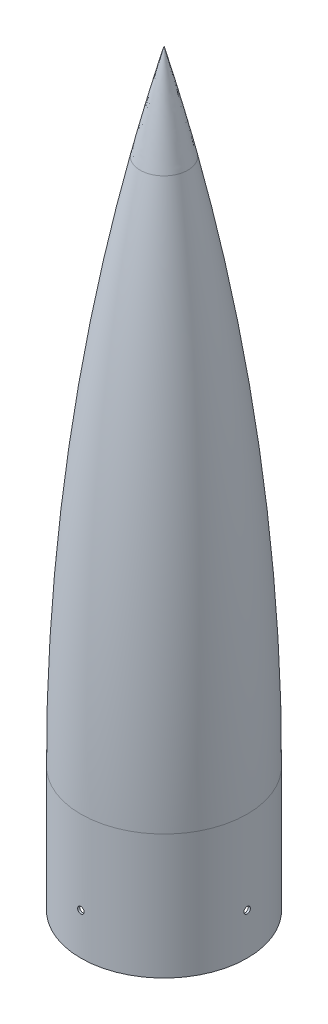
from build123d import *

# Parameters (mm, degrees)
SKETCH5_R          = 1.984375
CUT_EXTRUDE1_DEPTH = 12.7
CIRPATTERN1_COUNT  = 4


with BuildPart() as part:
    # Sketch1 → Revolve4 (revolve)
    with BuildSketch(Plane.XY, mode=Mode.PRIVATE) as revolve4_sk:
        with BuildLine():
            Line((-50.8, 76.2), (-50.8, 0))
            Line((-50.8, 0), (-49.53, 0))
            Line((-49.53, 0), (-49.53, 76.2))
            ThreePointArc((-49.53, 76.2), (-40.43567342, 238.505956843), (-13.266545858, 398.78))
            Line((-13.266545858, 398.78), (-14.569026637, 398.78))
            ThreePointArc((-14.569026637, 398.78), (-41.71386971, 238.504143378), (-50.8, 76.2))
        make_face()
    revolve(revolve4_sk.sketch.rotate(Axis((0, 0, 0), (0, 1, 0)), 270), axis=Axis((0, 0, 0), (0, 1, 0)))

    # Sketch5 → Cut-Extrude1 (cut)
    with BuildSketch(Plane(origin=(-80.274174728, -85.965568301, 50.8), x_dir=(1, 0, 0), z_dir=(0, 0, 1))):
        with Locations((80.274174728, 111.365568301)):
            Circle(SKETCH5_R)
    cut_extrude1 = extrude(amount=-CUT_EXTRUDE1_DEPTH, mode=Mode.SUBTRACT)

    # CirPattern1: Cut-Extrude1 ×4 about axis
    cirpattern1_axis = Axis((0, 0, 0), (0, -1, 0))
    for i in range(1, CIRPATTERN1_COUNT):
        add(cut_extrude1.rotate(cirpattern1_axis, i * 360 / CIRPATTERN1_COUNT), mode=Mode.SUBTRACT)


with BuildPart() as body_2:
    # Sketch4 → Revolve5 (revolve)
    with BuildSketch(Plane.XY, mode=Mode.PRIVATE) as revolve5_sk:
        with BuildLine():
            Line((0, 398.78), (0, 457.2))
            ThreePointArc((0, 457.2), (-7.58690655, 428.065412103), (-14.569026637, 398.78))
            Line((-14.569026637, 398.78), (0, 398.78))
        make_face()
    revolve(revolve5_sk.sketch.rotate(Axis((0, 398.78, 0), (0, -1, 0)), 90), axis=Axis((0, 398.78, 0), (0, -1, 0)))


solid = Compound([part.part, body_2.part])
